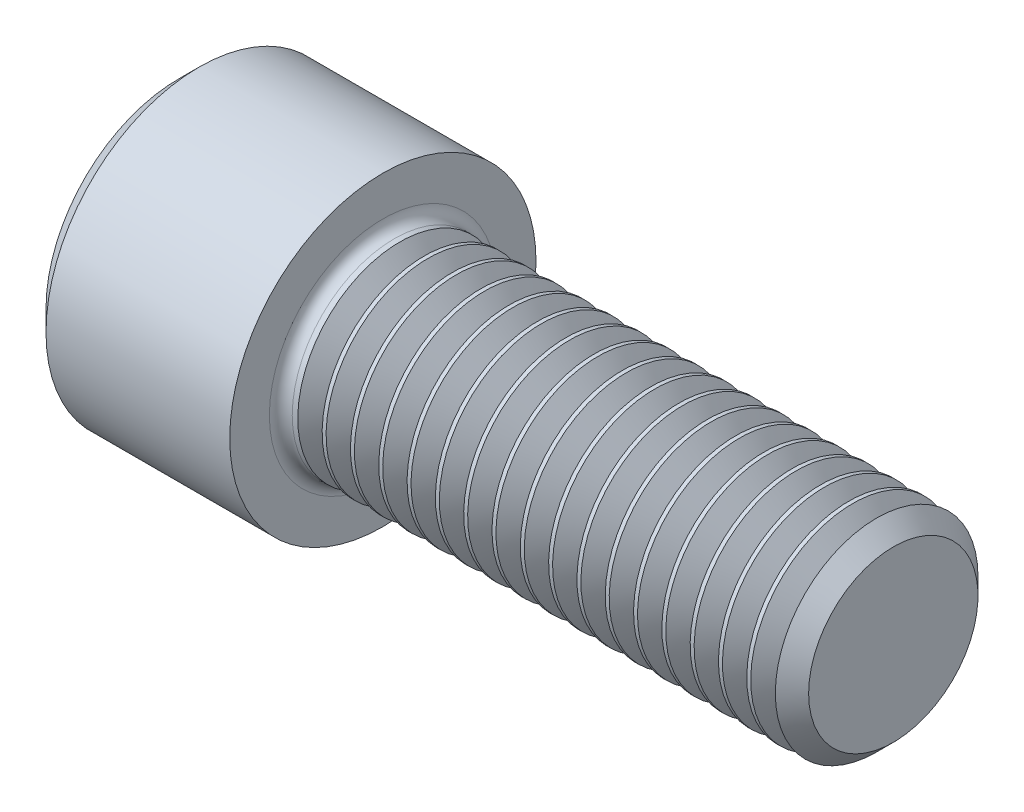
from build123d import *

# Parameters (mm, degrees)
FILLET1_R       = 0.3556
HEX_2_DEPTH     = 3.048
THDSCHPAT_COUNT = 17
THDSCHPAT_PITCH = 0.880483529


with BuildPart() as part:
    # BodySke → Base-Revolve (revolve)
    with BuildSketch(Plane.XY, mode=Mode.PRIVATE) as base_revolve_sk:
        Polygon((0, 0), (0, 4.1275), (0.635, 4.7625), (6.35, 4.7625), (6.35, 3.175), (21.68398, 3.175), (22.225, 2.63398), (22.225, 0), align=None)
    revolve(base_revolve_sk.sketch.rotate(Axis((-31.75, 0, 0), (1, 0, 0)), 90), axis=Axis((-31.75, 0, 0), (1, 0, 0)))

    # Fillet1
    fillet1_edges = [part.edges().sort_by_distance(p)[0] for p in [
        (6.35, 0, -3.175),
    ]]
    fillet(fillet1_edges, radius=FILLET1_R)

    # Sketch2 → Hex-PreBroach (revolve, cut)
    with BuildSketch(Plane.XY, mode=Mode.PRIVATE) as hex_prebroach_sk:
        Polygon((0, 2.38125), (3.048, 2.38125), (4.422815329, 0), (0, 0), align=None)
    revolve(hex_prebroach_sk.sketch.rotate(Axis((0, 0, 0), (1, 0, 0)), 90), axis=Axis((0, 0, 0), (1, 0, 0)), mode=Mode.SUBTRACT)

    # Sketch3 → Hex 2 (cut)
    with BuildSketch(Plane(origin=(0, 0, 0), x_dir=(0, 0.500000000000001, 0.866025403784438), z_dir=(-1, 0, 0))):
        Polygon((1.374815329, 2.38125), (-1.374815329, 2.38125), (-2.749630657, 0), (-1.374815329, -2.38125), (1.374815329, -2.38125), (2.749630657, 0), align=None)
    extrude(amount=-HEX_2_DEPTH, mode=Mode.SUBTRACT)

    # ThdSchSke → ThreadSchematic (revolve, cut)
    with BuildSketch(Plane.XY):
        Polygon((7.25678, -2.63398), (6.877953718, -3.175), (6.877953718, -3.96875), (7.635606282, -3.96875), (7.635606282, -3.175), align=None)
    threadschematic = revolve(axis=Axis((-3.175, 0, 0), (1, 0, 0)), mode=Mode.SUBTRACT)

    # ThdSchPat: ThreadSchematic ×17
    with Locations(*[(i * THDSCHPAT_PITCH, 0, 0) for i in range(1, THDSCHPAT_COUNT)]):
        add(threadschematic, mode=Mode.SUBTRACT)


solid = part.part
